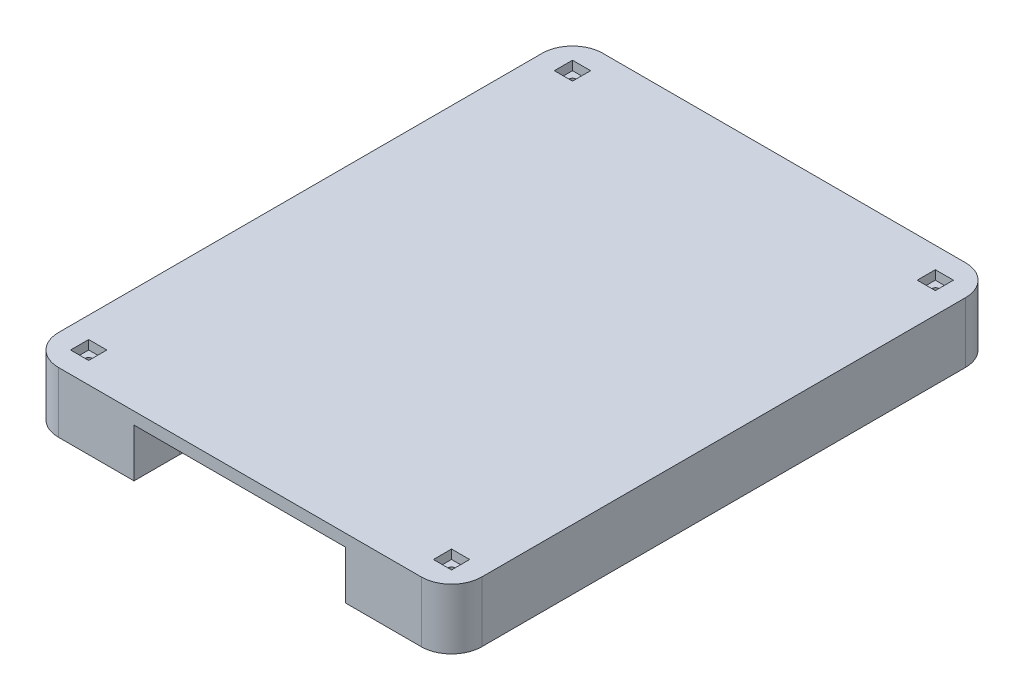
from build123d import *

# Parameters (mm, degrees)
SKETCH_1_W                                 = 200
SKETCH_1_H                                 = 200
EXTRUDE_1_DEPTH                            = 20
SKETCH_2_W                                 = 200
SKETCH_2_H                                 = 200
SKETCH_2_W_2                               = 140
SKETCH_2_H_2                               = 180
CUT_EXTRUDE_2_DEPTH                        = 143.828568571
FILLET_1_R                                 = 10
FILLET_2_R                                 = 10
FILLET_3_R                                 = 10
FILLET_4_R                                 = 10
CUT_EXTRUDE_4_DEPTH                        = 5
MIRROR_3_AT_THE_SECOND_PLANE_COPY_1_DEPTH  = 5
SKETCH_5_R                                 = 5
CUT_EXTRUDE_5_DEPTH                        = 6.2
CUT_EXTRUDE_7_DEPTH                        = 16
SKETCH_8_R                                 = 4.1
CUT_EXTRUDE_8_DEPTH                        = 4
DRAFT_2_ANGLE                              = 10
DRAFT_2_OF_MIRROR_10_2_ANGLE               = 10
DRAFT_2_OF_MIRROR_11_2_ANGLE               = 10
SKETCH_14_W                                = 6
SKETCH_14_H                                = 6
CUT_EXTRUDE_9_DEPTH                        = 3
MIRROR_12_AT_THE_SECOND_PLANE_COPY_1_SKE_W = 6
MIRROR_12_AT_THE_SECOND_PLANE_COPY_1_SKE_H = 6
MIRROR_12_AT_THE_SECOND_PLANE_COPY_1_DEPTH = 3
SKETCH_18_R                                = 1.2
CUT_EXTRUDE_11_DEPTH                       = 116.758369028
MIRROR_16_AT_THE_SECOND_PLANE_COPY_1_SKE_R = 1.2
MIRROR_16_AT_THE_SECOND_PLANE_COPY_1_DEPTH = 116.758369028


with BuildPart() as part:
    # 草图1 → 凸台-拉伸1 (new body)
    with BuildSketch(Plane(origin=(0, 0, 0), x_dir=(1, 0, 0), z_dir=(0, 1, 0))):
        Rectangle(SKETCH_1_W, SKETCH_1_H)
    extrude(amount=EXTRUDE_1_DEPTH)

    # 草图2 → 切除-拉伸2 (cut, through all)
    with BuildSketch(Plane(origin=(0, 20, 0), x_dir=(1, 0, 0), z_dir=(0, 1, 0))):
        Rectangle(SKETCH_2_W, SKETCH_2_H)
        Rectangle(SKETCH_2_W_2, SKETCH_2_H_2, mode=Mode.SUBTRACT)
    extrude(amount=-CUT_EXTRUDE_2_DEPTH, mode=Mode.SUBTRACT)

    # 圆角1
    fillet_1_edges = [part.edges().sort_by_distance(p)[0] for p in [
        (-70, 10, -90),
    ]]
    fillet(fillet_1_edges, radius=FILLET_1_R)

    # 圆角2
    fillet_2_edges = [part.edges().sort_by_distance(p)[0] for p in [
        (70, 10, -90),
    ]]
    fillet(fillet_2_edges, radius=FILLET_2_R)

    # 圆角3
    fillet_3_edges = [part.edges().sort_by_distance(p)[0] for p in [
        (70, 10, 90),
    ]]
    fillet(fillet_3_edges, radius=FILLET_3_R)

    # 圆角4
    fillet_4_edges = [part.edges().sort_by_distance(p)[0] for p in [
        (-70, 10, 90),
    ]]
    fillet(fillet_4_edges, radius=FILLET_4_R)

    # 草图4 → 切除-拉伸4 (cut)
    with BuildSketch(Plane.XZ):
        with BuildLine():
            Line((-59.5, 84.974937186), (-59.5, 86))
            Line((-59.5, 86), (-60.5, 86))
            Line((-60.5, 86), (-60.5, 84.974937186))
            ThreePointArc((-60.5, 84.974937186), (-63.535533906, 83.535533906), (-64.974937186, 80.5))
            Line((-64.974937186, 80.5), (-66, 80.5))
            Line((-66, 80.5), (-66, 79.5))
            Line((-66, 79.5), (-64.974937186, 79.5))
            ThreePointArc((-64.974937186, 79.5), (-63.535533906, 76.464466094), (-60.5, 75.025062814))
            Line((-60.5, 75.025062814), (-60.5, 74))
            Line((-60.5, 74), (-59.5, 74))
            Line((-59.5, 74), (-59.5, 75.025062814))
            ThreePointArc((-59.5, 75.025062814), (-56.464466094, 76.464466094), (-55.025062814, 79.5))
            Line((-55.025062814, 79.5), (-54, 79.5))
            Line((-54, 79.5), (-54, 80.5))
            Line((-54, 80.5), (-55.025062814, 80.5))
            ThreePointArc((-55.025062814, 80.5), (-56.464466094, 83.535533906), (-59.5, 84.974937186))
        make_face()
    cut_extrude_4 = extrude(amount=-CUT_EXTRUDE_4_DEPTH, mode=Mode.SUBTRACT)

    # 镜向3: 切除-拉伸4 across plane
    add(cut_extrude_4.mirror(Plane(origin=(0, 0, 0), x_dir=(0, 0, 1), z_dir=(1, 0, 0))), mode=Mode.SUBTRACT)

    # 镜向3 at the second plane: 切除-拉伸4 across plane
    add(cut_extrude_4.mirror(Plane.XY), mode=Mode.SUBTRACT)

    # 镜向3 at the second plane copy 1 sket → 镜向3 at the second plane copy 1 (cut)
    with BuildSketch(Plane(origin=(0, 0, 0), x_dir=(-1, 0, 0), z_dir=(0, -1, 0))):
        with BuildLine():
            Line((-59.5, 84.974937186), (-59.5, 86))
            Line((-59.5, 86), (-60.5, 86))
            Line((-60.5, 86), (-60.5, 84.974937186))
            ThreePointArc((-60.5, 84.974937186), (-63.535533906, 83.535533906), (-64.974937186, 80.5))
            Line((-64.974937186, 80.5), (-66, 80.5))
            Line((-66, 80.5), (-66, 79.5))
            Line((-66, 79.5), (-64.974937186, 79.5))
            ThreePointArc((-64.974937186, 79.5), (-63.535533906, 76.464466094), (-60.5, 75.025062814))
            Line((-60.5, 75.025062814), (-60.5, 74))
            Line((-60.5, 74), (-59.5, 74))
            Line((-59.5, 74), (-59.5, 75.025062814))
            ThreePointArc((-59.5, 75.025062814), (-56.464466094, 76.464466094), (-55.025062814, 79.5))
            Line((-55.025062814, 79.5), (-54, 79.5))
            Line((-54, 79.5), (-54, 80.5))
            Line((-54, 80.5), (-55.025062814, 80.5))
            ThreePointArc((-55.025062814, 80.5), (-56.464466094, 83.535533906), (-59.5, 84.974937186))
        make_face()
    extrude(amount=-MIRROR_3_AT_THE_SECOND_PLANE_COPY_1_DEPTH, mode=Mode.SUBTRACT)

    # 草图5 → 切除-拉伸5 (cut)
    with BuildSketch(Plane.XZ):
        with Locations(Location((-60, 80, 0), (0, 0, 270))):
            Circle(SKETCH_5_R)
    extrude(amount=-CUT_EXTRUDE_5_DEPTH, mode=Mode.SUBTRACT)

    # 草图7 → 切除-拉伸7 (cut)
    with BuildSketch(Plane.XZ):
        with BuildLine():
            Line((35, 110), (-35, 110))
            Line((-35, 110), (-35, 75))
            ThreePointArc((-35, 75), (-33.535533906, 71.464466094), (-30, 70))
            Line((-30, 70), (30, 70))
            ThreePointArc((30, 70), (33.535533906, 71.464466094), (35, 75))
            Line((35, 75), (35, 110))
        make_face()
    cut_extrude_7 = extrude(amount=-CUT_EXTRUDE_7_DEPTH, mode=Mode.SUBTRACT)

    # 镜向6: 切除-拉伸7 across plane
    add(cut_extrude_7.mirror(Plane.XY), mode=Mode.SUBTRACT)

    # 草图8 → 切除-拉伸8 (cut)
    with BuildSketch(Plane.XZ):
        with Locations(Location((-40.5, 40.5, 0), (0, 0, 270))):
            Circle(SKETCH_8_R)
    cut_extrude_8 = extrude(amount=-CUT_EXTRUDE_8_DEPTH, mode=Mode.SUBTRACT)

    # 拔模2
    draft_2_faces = [part.faces().sort_by_distance(p)[0] for p in [
        (-40.5, 2, 44.6),
    ]]
    draft(draft_2_faces, Plane(origin=(-40.5, 4, 40.5), x_dir=(0, 0, -1), z_dir=(0, -1, 0)), DRAFT_2_ANGLE)

    # 镜向10: 切除-拉伸8 across plane
    add(cut_extrude_8.mirror(Plane(origin=(0, 0, 0), x_dir=(0, 0, 1), z_dir=(1, 0, 0))), mode=Mode.SUBTRACT)

    # 拔模2 of Mirror 10 2
    draft_2_of_mirror_10_2_faces = [part.faces().sort_by_distance(p)[0] for p in [
        (40.5, 2, 44.6),
    ]]
    draft(draft_2_of_mirror_10_2_faces, Plane(origin=(40.5, 4, 40.5), x_dir=(0, 0, -1), z_dir=(0, -1, 0)), DRAFT_2_OF_MIRROR_10_2_ANGLE)

    # 镜向11: 切除-拉伸8 across plane
    add(cut_extrude_8.mirror(Plane.XY), mode=Mode.SUBTRACT)

    # 拔模2 of Mirror 11 2
    draft_2_of_mirror_11_2_faces = [part.faces().sort_by_distance(p)[0] for p in [
        (-40.5, 2, -44.6),
    ]]
    draft(draft_2_of_mirror_11_2_faces, Plane(origin=(-40.5, 4, -40.5), x_dir=(0, 0, 1), z_dir=(0, -1, 0)), DRAFT_2_OF_MIRROR_11_2_ANGLE)

    # 草图14 → 切除-拉伸9 (cut)
    with BuildSketch(Plane(origin=(0, 20, 0), x_dir=(1, 0, 0), z_dir=(0, 1, 0))):
        with Locations((-60, 80)):
            Rectangle(SKETCH_14_W, SKETCH_14_H)
    cut_extrude_9 = extrude(amount=-CUT_EXTRUDE_9_DEPTH, mode=Mode.SUBTRACT)

    # 镜向12: 切除-拉伸9 across plane
    add(cut_extrude_9.mirror(Plane(origin=(0, 0, 0), x_dir=(0, 0, 1), z_dir=(1, 0, 0))), mode=Mode.SUBTRACT)

    # 镜向12 at the second plane: 切除-拉伸9 across plane
    add(cut_extrude_9.mirror(Plane.XY), mode=Mode.SUBTRACT)

    # 镜向12 at the second plane copy 1 ske → 镜向12 at the second plane copy 1 (cut)
    with BuildSketch(Plane(origin=(0, 20, 0), x_dir=(-1, 0, 0), z_dir=(0, 1, 0))):
        with Locations((-60, 80)):
            Rectangle(MIRROR_12_AT_THE_SECOND_PLANE_COPY_1_SKE_W, MIRROR_12_AT_THE_SECOND_PLANE_COPY_1_SKE_H)
    extrude(amount=-MIRROR_12_AT_THE_SECOND_PLANE_COPY_1_DEPTH, mode=Mode.SUBTRACT)

    # 草图18 → 切除-拉伸11 (cut, through all)
    with BuildSketch(Plane.XZ):
        with Locations(Location((-60, 80, 0), (0, 0, 270))):
            Circle(SKETCH_18_R)
    cut_extrude_11 = extrude(amount=-CUT_EXTRUDE_11_DEPTH, mode=Mode.SUBTRACT)

    # 镜向16: 切除-拉伸11 across plane
    add(cut_extrude_11.mirror(Plane(origin=(0, 0, 0), x_dir=(0, 0, 1), z_dir=(1, 0, 0))), mode=Mode.SUBTRACT)

    # 镜向16 at the second plane: 切除-拉伸11 across plane
    add(cut_extrude_11.mirror(Plane.XY), mode=Mode.SUBTRACT)

    # 镜向16 at the second plane copy 1 ske → 镜向16 at the second plane copy 1 (cut, through all)
    with BuildSketch(Plane(origin=(0, 0, 0), x_dir=(-1, 0, 0), z_dir=(0, -1, 0))):
        with Locations(Location((-60, 80, 0), (0, 0, 270))):
            Circle(MIRROR_16_AT_THE_SECOND_PLANE_COPY_1_SKE_R)
    extrude(amount=-MIRROR_16_AT_THE_SECOND_PLANE_COPY_1_DEPTH, mode=Mode.SUBTRACT)


solid = part.part
